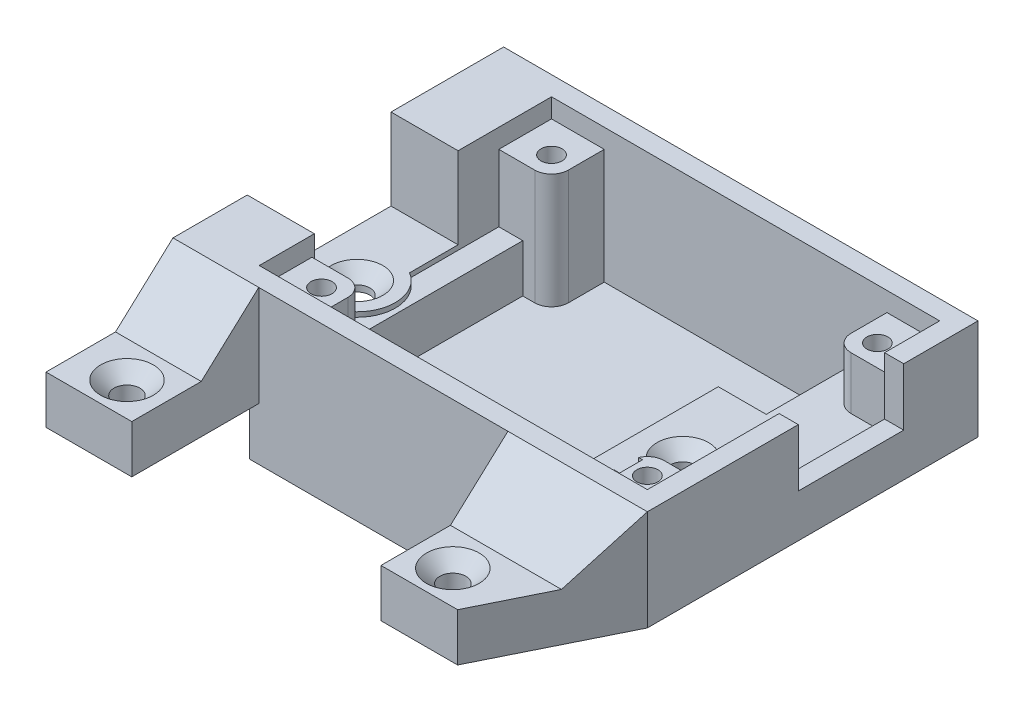
from build123d import *

# Parameters (mm, degrees)
SKETCH_1_W                          = 44.5
SKETCH_1_H                          = 34.5
EXTRUDE_1_DEPTH                     = 16
SHELL_1_T                           = -2
SKETCH_2_W                          = 5.5000000000000036
SKETCH_2_H                          = 5.499999999999993
EXTRUDE_2_DEPTH                     = 12
SKETCH_3_R                          = 1.0999999999999992
CUT_EXTRUDE_1_DEPTH                 = 32.44240766862487
FILLET_1_R                          = 1.75
SKETCH_7_W                          = 15.099999999999996
SKETCH_7_H                          = 34.5
CUT_EXTRUDE_4_DEPTH                 = 7
SKETCH_8_W                          = 15.099999999999996
SKETCH_8_H                          = 34.5
SKETCH_8_R                          = 1.0999999999999992
EXTRUDE_3_DEPTH                     = 1.5
EXTRUDE_4_DEPTH                     = 1.5
CUT_EXTRUDE_6_DEPTH                 = 5
SKETCH_13_W                         = 34.5
SKETCH_13_H                         = 5.5
EXTRUDE_7_DEPTH                     = 1.5
SKETCH_14_R                         = 1.0999999999999992
SKETCH_14_R_2                       = 1.0999999999999954
CUT_EXTRUDE_7_DEPTH                 = 33.382479830920914
EXTRUDE_8_DEPTH                     = 10.5
SKETCH_18_W                         = 8.950000000000003
SKETCH_18_H                         = 13.250000000000004
SKETCH_18_R                         = 1.3500000000000054
SKETCH_18_R_2                       = 1.3500000000000005
EXTRUDE_9_DEPTH                     = 5
CUT_EXTRUDE_8_DEPTH                 = 43.22632472759144
CUT_EXTRUDE_8_DEPTH_BACK            = 43.22632472759144
SKETCH_18_3_R                       = 1.3500000000000059
SKETCH_18_3_R_2                     = 1.3500000000000005
HOLE_WIZARD_M2_5_1_D                = 2.7
HOLE_WIZARD_M2_5_1_DEPTH            = 24.83
HOLE_WIZARD_M2_5_1_CSINK_D          = 5.5
HOLE_WIZARD_M2_5_1_CSINK_ANGLE      = 90
HOLE_WIZARD_M2_5_1_TIP              = 0.8111618356872065
EXTRUDE_10_DEPTH                    = 8.95
SKETCH_22_W                         = 2
SKETCH_22_H                         = 2.399999999999997
CUT_EXTRUDE_9_DEPTH                 = 1
HOLE_WIZARD_1_D                     = 2.2
HOLE_WIZARD_1_CSINK_D               = 4.5
HOLE_WIZARD_1_CSINK_ANGLE           = 90
CUT_EXTRUDE_10_DEPTH                = 42.878544626097025
EXTRUDE_11_DEPTH                    = 2
EXTRUDE_START                       = -2
EXTRUDE_12_DEPTH                    = 2
EXTRUDE_13_DEPTH                    = 2
EXTRUDE_14_DEPTH                    = 2
SKETCH_31_W                         = 15
SKETCH_31_H                         = 8.5
CUT_EXTRUDE_11_DEPTH                = 10
EXTRUDE_START_2                     = 1.5
SKETCH_32_R                         = 1.3500000000000005
EXTRUDE_15_DEPTH                    = 1.5
EXTRUDE_START_3                     = -0.5
SKETCH_34_R                         = 3.999999999999999
SKETCH_34_R_2                       = 1.3500000000000059
EXTRUDE_18_DEPTH                    = 0.5
HOLE_WIZARD_2_D                     = 2.7
HOLE_WIZARD_2_CSINK_D               = 5.4
HOLE_WIZARD_2_CSINK_ANGLE           = 90
HOLE_WIZARD_2_ON_FACE_2_D           = 2.7
HOLE_WIZARD_2_ON_FACE_2_CSINK_D     = 5.4
HOLE_WIZARD_2_ON_FACE_2_CSINK_ANGLE = 90
EXTRUDE_19_DEPTH                    = 5
EXTRUDE_20_DEPTH                    = 17.499999999999996
CUT_EXTRUDE_12_DEPTH                = 17.499999999999996


with BuildPart() as part:
    # 草图1 → 凸台-拉伸1 (new body)
    with BuildSketch(Plane(origin=(0, 0, 0), x_dir=(1, 0, 0), z_dir=(0, 1, 0))):
        Rectangle(SKETCH_1_W, SKETCH_1_H)
    extrude(amount=EXTRUDE_1_DEPTH)

    # 抽壳1
    shell_1_openings = [part.faces().sort_by_distance(p)[0] for p in [
        (0, 16, 0),
    ]]
    offset(amount=SHELL_1_T, openings=shell_1_openings, kind=Kind.INTERSECTION)

    # 草图2 → 凸台-拉伸2 (add)
    with BuildSketch(Plane(origin=(0, 2, 0), x_dir=(1, 0, 0), z_dir=(0, 1, 0))):
        Polygon((20.249999999999996, -15.250000000000002), (20.25, -9.75), (14.749999999999993, -9.749999999999996), (14.749999999999995, -15.250000000000005), align=None)
        Polygon((-20.249999999999996, 15.250000000000002), (-14.749999999999995, 15.250000000000002), (-14.749999999999995, 9.750000000000002), (-20.249999999999993, 9.750000000000002), align=None)
        with Locations((-17.499999999999993, -12.500000000000005)):
            Rectangle(SKETCH_2_W, SKETCH_2_H)
        Polygon((20.249999999999996, 9.75), (14.749999999999991, 9.749999999999996), (14.749999999999991, 15.250000000000005), (20.249999999999996, 15.250000000000002), align=None)
    extrude(amount=EXTRUDE_2_DEPTH)

    # 草图3 → 切除-拉伸1 (cut, through all)
    with BuildSketch(Plane(origin=(0, 14, 0), x_dir=(1, 0, 0), z_dir=(0, 1, 0))):
        with Locations(Location((-17, 12, 0), (0, 0, 270))):
            Circle(SKETCH_3_R)
        with Locations(Location((17, 12, 0), (0, 0, 90))):
            Circle(SKETCH_3_R)
        with Locations(Location((17, -12, 0), (0, 0, 270))):
            Circle(SKETCH_3_R)
        with Locations(Location((-17, -12, 0), (0, 0, 90))):
            Circle(SKETCH_3_R)
    extrude(amount=-CUT_EXTRUDE_1_DEPTH, mode=Mode.SUBTRACT)

    # 圆角1
    fillet_1_edges = [part.edges().sort_by_distance(p)[0] for p in [
        (-14.749999999999995, 8, -9.750000000000002),
        (-14.749999999999993, 8, 9.750000000000009),
        (14.749999999999993, 8, 9.749999999999996),
        (14.749999999999991, 8, -9.749999999999996),
    ]]
    fillet(fillet_1_edges, radius=FILLET_1_R)

    # 草图7 → 切除-拉伸4 (cut)
    with BuildSketch(Plane.XZ):
        with Locations((14.700000000000003, 0)):
            Rectangle(SKETCH_7_W, SKETCH_7_H)
        Polygon((-22.25, 17.25), (-17.75, 17.25), (-17.74999999999999, -17.25), (-22.25, -17.25), align=None)
    extrude(amount=-CUT_EXTRUDE_4_DEPTH, mode=Mode.SUBTRACT)

    # 草图8 → 凸台-拉伸3 (add)
    # profile 1 of 2: a face of its own
    with BuildSketch(Plane.XZ.offset(-7)):
        with Locations((14.700000000000003, 0)):
            Rectangle(SKETCH_8_W, SKETCH_8_H)
        with Locations(Location((17, 12, 0), (0, 0, 90))):
            Circle(SKETCH_8_R, mode=Mode.SUBTRACT)
        with Locations(Location((17, -12, 0), (0, 0, 270))):
            Circle(SKETCH_8_R, mode=Mode.SUBTRACT)
    # profile 2 of 2: a face of its own
    with BuildSketch(Plane.XZ.offset(-7)):
        Polygon((-22.25, 17.25), (-17.749999999999993, 17.25), (-17.74999999999999, -17.25), (-22.25, -17.25), align=None)
    extrude(amount=EXTRUDE_3_DEPTH)

    # 草图9 → 凸台-拉伸4 (add)
    with BuildSketch(Plane(origin=(7.150000000000004, 0, 0), x_dir=(0, 0, -1), z_dir=(1, 0, 0))):
        Polygon((17.25, 0), (-17.25, -4.16e-15), (-17.25, 5.5), (17.25, 5.5000000000000036), align=None)
    extrude(amount=EXTRUDE_4_DEPTH)

    # 草图12 → 切除-拉伸6 (cut)
    with BuildSketch(Plane(origin=(22.25, 0, 0), x_dir=(0, 0, -1), z_dir=(1, 0, 0))):
        Polygon((9.500000000000002, 10.000000000000002), (-1.4999999999999996, 10), (-1.4999999999999996, 16), (9.5, 16), align=None)
    extrude(amount=-CUT_EXTRUDE_6_DEPTH, mode=Mode.SUBTRACT)

    # 草图13 → 凸台-拉伸7 (add)
    with BuildSketch(Plane.ZY.offset(17.749999999999996)):
        with Locations((7.11e-15, 2.75)):
            Rectangle(SKETCH_13_W, SKETCH_13_H)
    extrude(amount=EXTRUDE_7_DEPTH)

    # 草图14 → 切除-拉伸7 (cut, through all)
    with BuildSketch(Plane.XZ):
        with Locations(Location((-17, 12, 0), (0, 0, 270))):
            Circle(SKETCH_14_R)
        with Locations(Location((-17, -12, 0), (0, 0, 90))):
            Circle(SKETCH_14_R_2)
    extrude(amount=-CUT_EXTRUDE_7_DEPTH, mode=Mode.SUBTRACT)

    # 草图16 → 凸台-拉伸8 (add)
    with BuildSketch(Plane.XZ.offset(-5.5)):
        Polygon((-22.25, 17.25), (-27.25, 17.25), (-27.249999999999996, -17.25), (-22.25, -17.25), align=None)
    extrude(amount=-EXTRUDE_8_DEPTH)

    # 草图18 → 凸台-拉伸9 (add)
    # profile 1 of 2: a face of its own
    with BuildSketch(Plane.XZ.offset(-5.5)):
        with Locations((-22.775000000000002, 23.875)):
            Rectangle(SKETCH_18_W, SKETCH_18_H)
        with Locations(Location((-22.299999999999994, 27, 0), (0, 0, 270))):
            Circle(SKETCH_18_R, mode=Mode.SUBTRACT)
    # profile 2 of 2: a face of its own
    with BuildSketch(Plane.XZ.offset(-5.5)):
        Polygon((7.700000000000007, 17.25), (15.7, 17.25), (15.7, 30.500000000000004), (7.7000000000000055, 30.500000000000004), align=None)
        with Locations(Location((11.700000000000003, 27, 0), (0, 0, 270))):
            Circle(SKETCH_18_R_2, mode=Mode.SUBTRACT)
    extrude(amount=-EXTRUDE_9_DEPTH)

    # 草图18<3> → 切除-拉伸8 (cut, two sides: drawn at the far end of the back side and taken through both)
    with BuildSketch(Plane.XZ.offset(-5.5).offset(-CUT_EXTRUDE_8_DEPTH_BACK)):
        with Locations(Location((-22.299999999999997, 3, 0), (0, 0, 270))):
            Circle(SKETCH_18_3_R)
        with Locations(Location((11.700000000000006, 3, 0), (0, 0, 90))):
            Circle(SKETCH_18_3_R_2)
    extrude(amount=CUT_EXTRUDE_8_DEPTH + CUT_EXTRUDE_8_DEPTH_BACK, mode=Mode.SUBTRACT)

    # M2.5 锥坑高头螺钉的锥形沉头孔1
    with Locations(Plane(origin=(-22.3, 10.5, 27), x_dir=(0, 0, 1), z_dir=(0, 1, 0))):
        with Locations((0, 0), (0, 34)):
            CounterSinkHole(HOLE_WIZARD_M2_5_1_D / 2, HOLE_WIZARD_M2_5_1_CSINK_D / 2, depth=HOLE_WIZARD_M2_5_1_DEPTH, counter_sink_angle=HOLE_WIZARD_M2_5_1_CSINK_ANGLE)
            with Locations((0, 0, -(HOLE_WIZARD_M2_5_1_DEPTH + HOLE_WIZARD_M2_5_1_TIP / 2))):  # 118° drill point
                Cone(0, HOLE_WIZARD_M2_5_1_D / 2, HOLE_WIZARD_M2_5_1_TIP, mode=Mode.SUBTRACT)

    # 草图20 → 凸台-拉伸10 (add)
    with BuildSketch(Plane(origin=(-18.3, 0, 0), x_dir=(0, 0, -1), z_dir=(1, 0, 0))):
        Polygon((-23.25, 10.499999999999998), (-17.25, 10.499999999999998), (-17.25, 16), align=None)
    extrude(amount=-EXTRUDE_10_DEPTH)

    # 草图22 → 切除-拉伸9 (cut)
    with BuildSketch(Plane(origin=(0, 14, 0), x_dir=(1, 0, 0), z_dir=(0, 1, 0))):
        with Locations((14.3, -12)):
            Rectangle(SKETCH_22_W, SKETCH_22_H)
    extrude(amount=-CUT_EXTRUDE_9_DEPTH, mode=Mode.SUBTRACT)

    # 打孔尺寸(%根据十字)槽沉头木螺钉的类型1 (through all)
    with Locations(Plane(origin=(-17, 0, 12), x_dir=(0, 0, -1), z_dir=(0, -1, 0))):
        with Locations((0, 0), (24, 0)):
            CounterSinkHole(HOLE_WIZARD_1_D / 2, HOLE_WIZARD_1_CSINK_D / 2, counter_sink_angle=HOLE_WIZARD_1_CSINK_ANGLE)

    # 草图25 → 切除-拉伸10 (cut, through all)
    with BuildSketch(Plane(origin=(0, 7, 0), x_dir=(1, 0, 0), z_dir=(0, 1, 0))):
        Polygon((7.150000000000004, 3.2500000000000027), (12.150000000000006, 3.2500000000000044), (12.150000000000006, 15.250000000000005), (7.150000000000005, 15.250000000000007), align=None)
    extrude(amount=-CUT_EXTRUDE_10_DEPTH, mode=Mode.SUBTRACT)

    # 草图26 → 凸台-拉伸11 (add)
    with BuildSketch(Plane(origin=(-1.13e-15, 0, -3.2500000000000004), x_dir=(-1, 0, 3.5e-16), z_dir=(-3.5e-16, 0, -1))):
        Polygon((-7.150000000000005, 7), (-12.150000000000007, 7), (-12.150000000000004, 0), (-7.150000000000005, -4.34e-15), align=None)
    extrude(amount=EXTRUDE_11_DEPTH)

    # 草图27 → 凸台-拉伸12 (add)
    with BuildSketch(Plane(origin=(0, 0, -17.25), x_dir=(-1, 0, 0), z_dir=(0, 0, -1)).offset(EXTRUDE_START)):
        Polygon((-12.150000000000002, 0), (-8.650000000000004, 0), (-8.650000000000004, 5.5), (-12.150000000000006, 5.5), align=None)
    extrude(amount=EXTRUDE_12_DEPTH)

    # 草图28 → 凸台-拉伸13 (add)
    with BuildSketch(Plane(origin=(12.150000000000004, -6.02e-15, -4.22e-15), x_dir=(-3.5e-16, 0, -1), z_dir=(1, -5e-16, -3.5e-16))):
        Polygon((17.249999999999996, 6.02e-15), (17.249999999999993, 5.500000000000011), (3.2500000000000004, 5.500000000000005), (3.2500000000000004, 6.02e-15), align=None)
    extrude(amount=EXTRUDE_13_DEPTH)

    # 草图29 → 凸台-拉伸14 (add)
    with BuildSketch(Plane.XZ):
        Polygon((12.150000000000002, -5.250000000000004), (7.150000000000003, -5.250000000000003), (7.150000000000005, -15.250000000000007), (12.149999999999999, -15.250000000000002), align=None)
    extrude(amount=-EXTRUDE_14_DEPTH)

    # 草图31 → 切除-拉伸11 (cut)
    with BuildSketch(Plane.ZY.offset(27.249999999999996)):
        with Locations((2.0000000000000053, 11.75)):
            Rectangle(SKETCH_31_W, SKETCH_31_H)
    extrude(amount=-CUT_EXTRUDE_11_DEPTH, mode=Mode.SUBTRACT)

    # 草图32 → 凸台-拉伸15 (add)
    with BuildSketch(Plane(origin=(0, 7, 0), x_dir=(1, 0, 0), z_dir=(0, 1, 0)).offset(EXTRUDE_START_2)):
        with BuildLine():
            Line((12.150000000000006, 15.250000000000005), (12.150000000000006, 5.250000000000004))
            Line((12.150000000000006, 5.250000000000004), (7.150000000000003, 5.250000000000003))
            Line((7.150000000000003, 5.250000000000003), (7.150000000000004, -15.25))
            Line((7.150000000000004, -15.25), (14.749999999999995, -15.250000000000005))
            Line((14.749999999999995, -15.250000000000005), (14.749999999999993, -11.499999999999998))
            ThreePointArc((14.749999999999993, -11.499999999999998), (15.262563132923535, -10.26256313292354), (16.499999999999993, -9.749999999999998))
            Line((16.499999999999993, -9.749999999999998), (20.25, -9.75))
            Line((20.25, -9.75), (20.249999999999996, 9.750000000000002))
            Line((20.249999999999996, 9.750000000000002), (16.49999999999999, 9.749999999999998))
            ThreePointArc((16.49999999999999, 9.749999999999998), (15.262563132923532, 10.262563132923542), (14.749999999999991, 11.5))
            Line((14.749999999999991, 11.5), (14.749999999999991, 15.250000000000005))
            Line((14.749999999999991, 15.250000000000005), (12.150000000000006, 15.250000000000005))
        make_face()
        with Locations(Location((11.700000000000006, -3, 0), (0, 0, 270))):
            Circle(SKETCH_32_R, mode=Mode.SUBTRACT)
    extrude(amount=-EXTRUDE_15_DEPTH)

    # 草图34 → 凸台-拉伸18 (add)
    with BuildSketch(Plane(origin=(0, 7.5, 0), x_dir=(1, 0, 0), z_dir=(0, 1, 0)).offset(EXTRUDE_START_3)):
        with Locations((-22.299999999999997, -3)):
            Circle(SKETCH_34_R)
        with Locations(Location((-22.299999999999997, -3, 0), (0, 0, 90))):
            Circle(SKETCH_34_R_2, mode=Mode.SUBTRACT)
    extrude(amount=EXTRUDE_18_DEPTH)

    # 打孔尺寸(%根据十字)槽沉头木螺钉的类型2 (through all)
    with Locations(Plane(origin=(11.7, 8.5, 3), x_dir=(0, 0, 1), z_dir=(0, 1, 0))):
        with Locations((0, 0)):
            CounterSinkHole(HOLE_WIZARD_2_D / 2, HOLE_WIZARD_2_CSINK_D / 2, counter_sink_angle=HOLE_WIZARD_2_CSINK_ANGLE)

    # 打孔尺寸(%根据十字)槽沉头木螺钉的类型2 on face 2 (through all)
    with Locations(Plane(origin=(-22.3, 7.5, 3), x_dir=(0, 0, 1), z_dir=(0, 1, 0))):
        with Locations((0, 0)):
            CounterSinkHole(HOLE_WIZARD_2_ON_FACE_2_D / 2, HOLE_WIZARD_2_ON_FACE_2_CSINK_D / 2, counter_sink_angle=HOLE_WIZARD_2_ON_FACE_2_CSINK_ANGLE)

    # 草图35 → 凸台-拉伸19 (add)
    with BuildSketch(Plane(origin=(0, 10.499999999999998, 0), x_dir=(1, 0, 0), z_dir=(0, 1, 0))):
        Polygon((15.7, -30.500000000000004), (15.7, -17.25), (22.25, -17.25), align=None)
    extrude(amount=-EXTRUDE_19_DEPTH)

    # 草图36 → 凸台-拉伸20 (add)
    with BuildSketch(Plane.ZY.offset(-7.70000000000001)):
        Polygon((17.25, 10.499999999999998), (23.250000000000004, 10.499999999999998), (17.25, 16), align=None)
    extrude(amount=-EXTRUDE_20_DEPTH)

    # 草图37 → 切除-拉伸12 (cut)
    with BuildSketch(Plane(origin=(0, 16, 0), x_dir=(1, 0, 0), z_dir=(0, 1, 0))):
        Polygon((15.7, -30.500000000000004), (22.25, -17.25), (25.200000000000006, -17.250000000000004), (25.200000000000006, -30.824811105739553), align=None)
    extrude(amount=-CUT_EXTRUDE_12_DEPTH, mode=Mode.SUBTRACT)


solid = part.part
